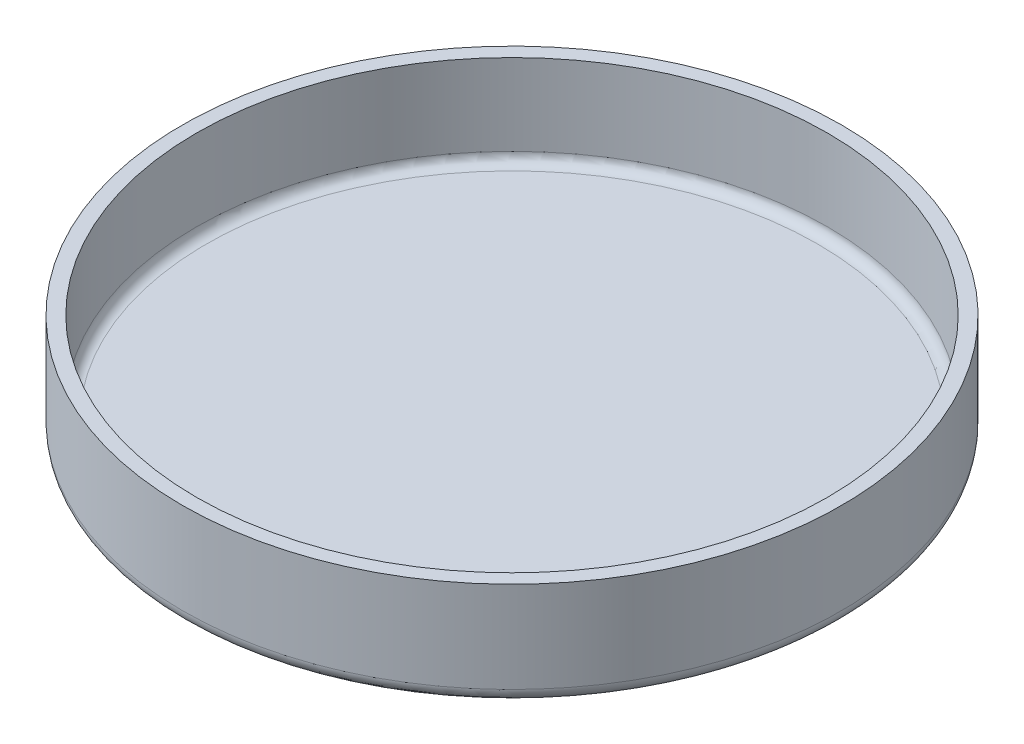
from build123d import *


with BuildPart() as part:
    # Croquis1 → Revolución1 (revolve)
    with BuildSketch(Plane.XY, mode=Mode.PRIVATE) as revoluci_n1_sk:
        with BuildLine():
            Line((45, 0), (0, 0))
            Line((0, 0), (0, 2))
            Line((0, 2), (43.585786438, 2))
            ThreePointArc((43.585786438, 2), (44.585786438, 2.414213562), (45, 3.414213562))
            Line((45, 3.414213562), (45, 15))
            Line((45, 15), (47, 15))
            Line((47, 15), (47, 2))
            ThreePointArc((47, 2), (46.414213562, 0.585786438), (45, 0))
        make_face()
    revolve(revoluci_n1_sk.sketch.rotate(Axis((0, 0, 0), (0, 1, 0)), 90), axis=Axis((0, 0, 0), (0, 1, 0)))


solid = part.part
